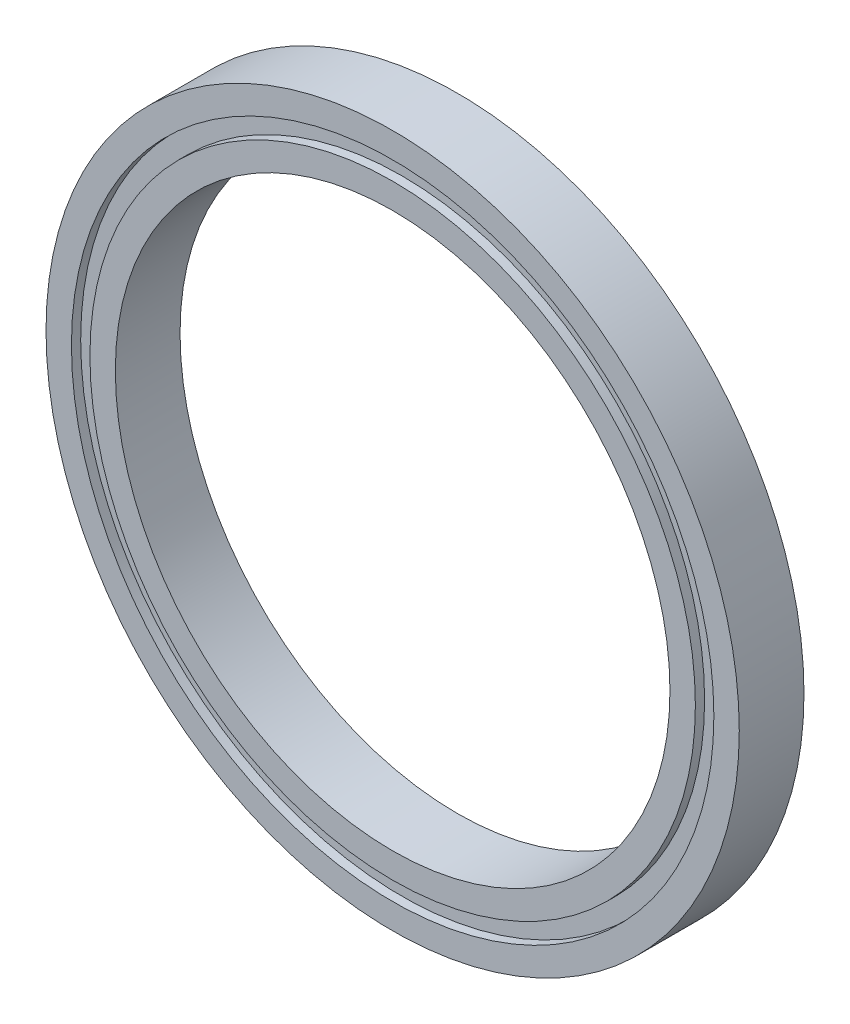
from build123d import *


with BuildPart() as part:
    # 草图1 → 旋转1 (revolve)
    with BuildSketch(Plane(origin=(0, 0, 0), x_dir=(0, 0, -1), z_dir=(1, 0, 0)), mode=Mode.PRIVATE) as revolve_1_sk:
        Polygon((-3.5, 37.5), (3.5, 37.5), (3.5, 34.75), (2.5, 34.75), (2.5, 32.75), (3.5, 32.75), (3.5, 30), (-3.5, 30), (-3.5, 32.75), (-2.5, 32.75), (-2.5, 34.75), (-3.5, 34.75), align=None)
    revolve(revolve_1_sk.sketch.rotate(Axis((0, 0, 0), (0, 0, 1)), 90), axis=Axis((0, 0, 0), (0, 0, 1)))


solid = part.part
